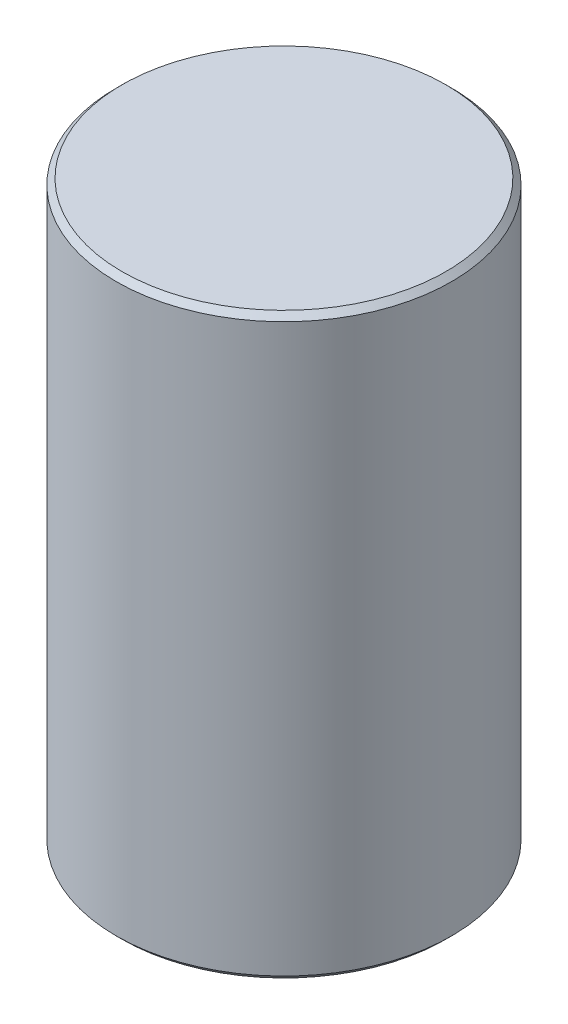
from build123d import *

# Parameters (mm, degrees)
SKETCH1_R           = 14.5
BOSS_EXTRUDE1_DEPTH = 50
SKETCH2_R           = 1.1
CUT_EXTRUDE1_DEPTH  = 47
CHAMFER1_SIZE       = 0.5


with BuildPart() as part:
    # Sketch1 → Boss-Extrude1 (new body)
    with BuildSketch(Plane(origin=(0, 0, 0), x_dir=(1, 0, 0), z_dir=(0, 1, 0))):
        with Locations(Location((0, 0, 0), (0, 0, 270))):
            Circle(SKETCH1_R)
    extrude(amount=BOSS_EXTRUDE1_DEPTH)

    # Sketch2 → Cut-Extrude1 (cut)
    with BuildSketch(Plane.XZ):
        with BuildLine():
            Line((-12.75, 0.9), (-12.75, -0.9))
            Line((-12.75, -0.9), (-11.638182396, -0.9))
            ThreePointArc((-11.638182396, -0.9), (-12.005537317, -1.66663011), (-12.573189655, -2.299435125))
            ThreePointArc((-12.573189655, -2.299435125), (-9.280361808, -8.789049136), (-2.979270067, -12.429660087))
            ThreePointArc((-2.979270067, -12.429660087), (0, -9.781725236), (2.979270067, -12.429660087))
            ThreePointArc((2.979270067, -12.429660087), (9.280361808, -8.789049136), (12.573189655, -2.299435125))
            ThreePointArc((12.573189655, -2.299435125), (12.005537317, -1.66663011), (11.638182396, -0.9))
            Line((11.638182396, -0.9), (12.75, -0.9))
            Line((12.75, -0.9), (12.75, 0.9))
            Line((12.75, 0.9), (11.638182396, 0.9))
            ThreePointArc((11.638182396, 0.9), (12.005537317, 1.66663011), (12.573189655, 2.299435125))
            ThreePointArc((12.573189655, 2.299435125), (9.280361808, 8.789049136), (2.979270067, 12.429660087))
            ThreePointArc((2.979270067, 12.429660087), (0, 9.781725236), (-2.979270067, 12.429660087))
            ThreePointArc((-2.979270067, 12.429660087), (-9.280361808, 8.789049136), (-12.573189655, 2.299435125))
            ThreePointArc((-12.573189655, 2.299435125), (-12.005537317, 1.66663011), (-11.638182396, 0.9))
            Line((-11.638182396, 0.9), (-12.75, 0.9))
        make_face()
        with Locations(Location((0, -12.781725236, 0), (0, 0, 270))):
            Circle(SKETCH2_R)
        with Locations(Location((0, 12.781725236, 0), (0, 0, 270))):
            Circle(SKETCH2_R)
    extrude(amount=-CUT_EXTRUDE1_DEPTH, mode=Mode.SUBTRACT)

    # Chamfer1
    chamfer1_edges = [part.edges().sort_by_distance(p)[0] for p in [
        (9.280361808, 47, 8.789049136),
        (0, 0, -14.5),
        (12.75, 47, 0),
        (-9.280361808, 47, -8.789049136),
        (-12.75, 47, 0),
        (-9.280361808, 0, -8.789049136),
        (9.280361808, 0, -8.789049136),
        (9.280361808, 0, 8.789049136),
        (-9.280361808, 0, 8.789049136),
        (0, 50, -14.5),
    ]]
    chamfer(chamfer1_edges, length=CHAMFER1_SIZE)


solid = part.part
